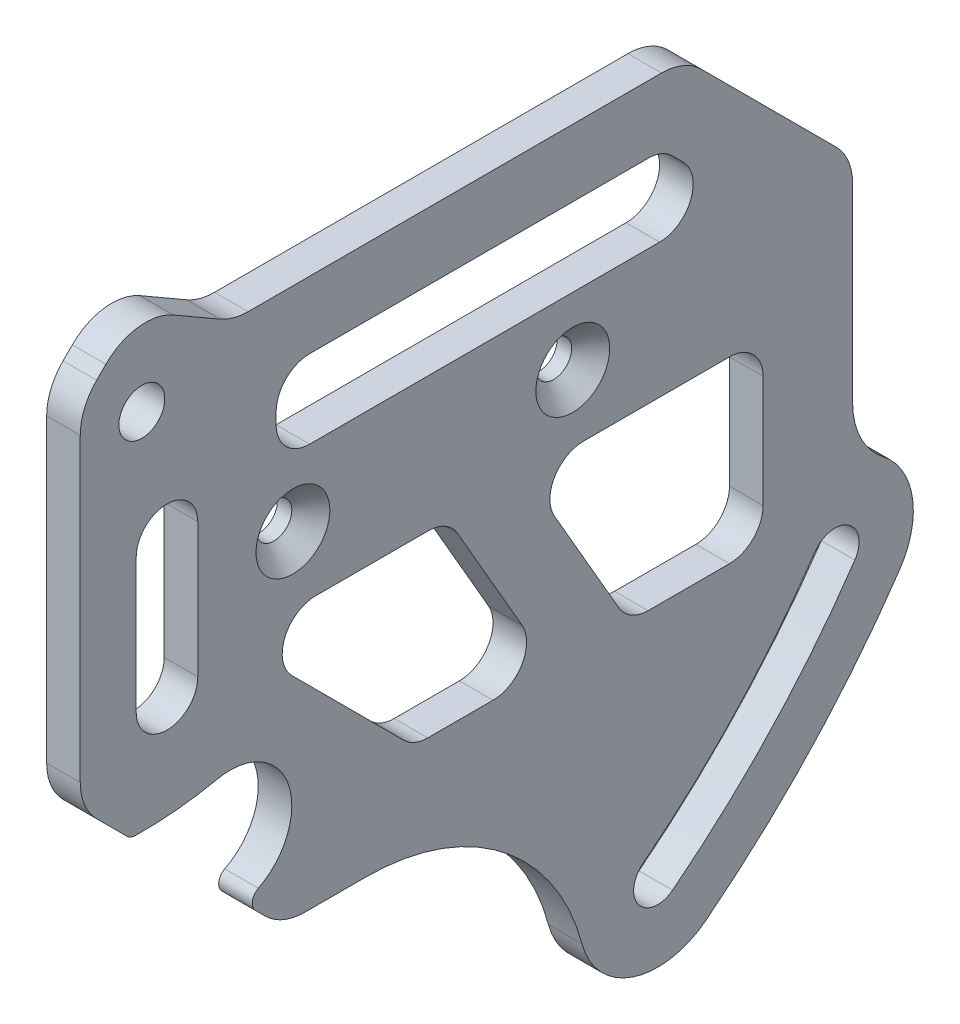
from build123d import *

# Parameters (mm, degrees)
SKETCH_1_R               = 1.6
SKETCH_1_R_2             = 2.05
EXTRUDE_1_DEPTH          = 3
HOLE_WIZARD_2_AT_2_COUNT = 2
HOLE_WIZARD_2_AT_2_PITCH = 25
FILLET_1_R               = 7
CUT_EXTRUDE_1_DEPTH      = 10
FILLET_2_R               = 1
CHAMFER_1_SIZE           = 15
FILLET_3_R               = 5
FILLET_4_R               = 3


with BuildPart() as part:
    # 草图1 → 凸台-拉伸1 (new body)
    with BuildSketch(Plane(origin=(0, 0, 0), x_dir=(0, 0, -1), z_dir=(1, 0, 0))):
        with BuildLine():
            Line((-17.839745962, 19), (37.5, 19))
            Line((37.5, 19), (37.5, -19.287265359))
            ThreePointArc((37.5, -19.287265359), (42.444079317, -23.554230469), (41.715171734, -30.044192356))
            ThreePointArc((41.715171734, -30.044192356), (33.776357191, -39.966054476), (24.398111919, -48.540238981))
            ThreePointArc((24.398111919, -48.540238981), (17.866480238, -49.660583483), (13.327617661, -44.831907605))
            ThreePointArc((13.327617661, -44.831907605), (6.185514087, -34.135545268), (-5.993117858, -30))
            Line((-5.993117858, -30), (-13.5, -30))
            Line((-13.5, -30), (-31.5, -12))
            Line((-31.5, -12), (-31.5, 19))
            Line((-31.5, 19), (-26.5, 24))
            Line((-26.5, 24), (-17.839745962, 19))
        make_face()
        with Locations((-12.5, 0)):
            Circle(SKETCH_1_R, mode=Mode.SUBTRACT)
        with Locations((12.5, 0)):
            Circle(SKETCH_1_R, mode=Mode.SUBTRACT)
        with Locations((-26, 16)):
            Circle(SKETCH_1_R_2, mode=Mode.SUBTRACT)
        Polygon((-17.701010127, -6), (1.334192463, -6), (10.57179677, -22), (-1.701010127, -22), align=None, mode=Mode.SUBTRACT)
        Polygon((29.5, -6), (29.5, -22), (17.5, -22), (8.262395693, -6), align=None, mode=Mode.SUBTRACT)
        Polygon((27.5, 6), (-14, 6), (-14, 13), (20.5, 13), align=None, mode=Mode.SUBTRACT)
        with BuildLine():
            Line((-21, 5), (-21, -7))
            ThreePointArc((-21, -7), (-23.75, -9.75), (-26.5, -7))
            Line((-26.5, -7), (-26.5, 5))
            ThreePointArc((-26.5, 5), (-23.75, 7.75), (-21, 5))
        make_face(mode=Mode.SUBTRACT)
        with BuildLine():
            ThreePointArc((18.766630925, -41.32851784), (18.395317666, -44.346319435), (21.413119261, -44.717632693))
            ThreePointArc((21.413119261, -44.717632693), (30.23590735, -36.651282249), (37.704519693, -27.317074793))
            ThreePointArc((37.704519693, -27.317074793), (37.135530181, -24.330228474), (34.148683862, -24.899217985))
            ThreePointArc((34.148683862, -24.899217985), (27.096951821, -33.712412026), (18.766630925, -41.32851784))
        make_face(mode=Mode.SUBTRACT)
    extrude(amount=EXTRUDE_1_DEPTH)

    # 草图3 → 打孔尺寸(%根据十字)槽沉头木螺钉的类型2 (revolve, cut)
    with BuildSketch(Plane(origin=(3, 0, -12.5), x_dir=(0, 0, -1), z_dir=(0, 1, 0))):
        Polygon((0, 0), (0, 3), (1.55, 3), (1.55, 1.75), (3.3, 0), align=None)
    hole_wizard_2 = revolve(axis=Axis((9.35, 0, -12.5), (-1, 0, 0)), mode=Mode.SUBTRACT)

    # 打孔尺寸(%根据十字)槽沉头木螺钉的类型2 at 2: 打孔尺寸(%根据十字)槽沉头木螺钉的类型2 ×2
    with Locations(*[(0, 0, i * HOLE_WIZARD_2_AT_2_PITCH) for i in range(1, HOLE_WIZARD_2_AT_2_COUNT)]):
        add(hole_wizard_2, mode=Mode.SUBTRACT)

    # 圆角1
    fillet_1_edges = [part.edges().sort_by_distance(p)[0] for p in [
        (1.5, -19.287265359, -37.5),
    ]]
    fillet(fillet_1_edges, radius=FILLET_1_R)

    # 草图5 → 切除-拉伸1 (cut)
    with BuildSketch(Plane(origin=(3, 0, 0), x_dir=(0, 0, -1), z_dir=(1, 0, 0))):
        with BuildLine():
            Line((-27.015881022, -16.484118978), (-16.951503299, -26.548496701))
            ThreePointArc((-16.951503299, -26.548496701), (-12.720005473, -20.02392536), (-19.242870048, -15.789797024))
            ThreePointArc((-19.242870048, -15.789797024), (-23.108459656, -16.37111358), (-27.015881022, -16.484118978))
        make_face()
    extrude(amount=-CUT_EXTRUDE_1_DEPTH, mode=Mode.SUBTRACT)

    # 圆角2
    fillet_2_edges = [part.edges().sort_by_distance(p)[0] for p in [
        (1.5, -26.548496701, 16.951503299),
        (1.5, -16.484118978, 27.015881022),
    ]]
    fillet(fillet_2_edges, radius=FILLET_2_R)

    # 倒角1
    chamfer_1_edges = [part.edges().sort_by_distance(p)[0] for p in [
        (1.5, 19, -37.5),
    ]]
    chamfer(chamfer_1_edges, length=CHAMFER_1_SIZE)

    # 圆角3
    fillet_3_edges = [part.edges().sort_by_distance(p)[0] for p in [
        (1.5, 19, -22.5),
        (1.5, 4, -37.5),
        (1.5, 24, 26.5),
        (1.5, 19, 17.839745962),
        (1.5, -30, 13.5),
        (1.5, -12, 31.5),
        (1.5, 19, 31.5),
    ]]
    fillet(fillet_3_edges, radius=FILLET_3_R)

    # 圆角4
    fillet_4_edges = [part.edges().sort_by_distance(p)[0] for p in [
        (1.5, -6, 17.701010127),
        (1.5, -22, 1.701010127),
        (1.5, -22, -10.57179677),
        (1.5, -6, -1.334192463),
        (1.5, -22, -17.5),
        (1.5, -22, -29.5),
        (1.5, -6, -29.5),
        (1.5, -6, -8.262395693),
        (1.5, 13, -20.5),
        (1.5, 13, 14),
        (1.5, 6, 14),
        (1.5, 6, -27.5),
    ]]
    fillet(fillet_4_edges, radius=FILLET_4_R)


solid = part.part
